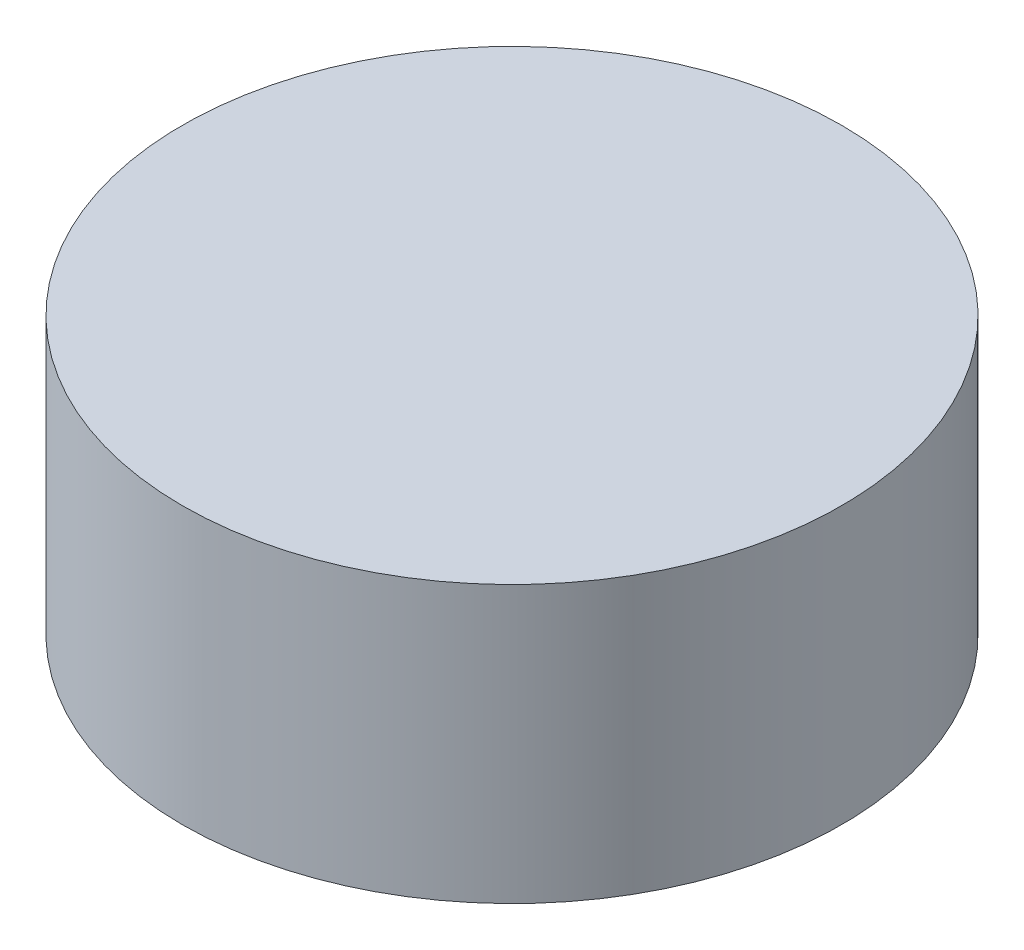
from build123d import *


with BuildPart() as part:
    # Sketch1 → Revolve1 (revolve)
    with BuildSketch(Plane(origin=(0, 0, 0), x_dir=(0, 0, -1), z_dir=(1, 0, 0)), mode=Mode.PRIVATE) as revolve1_sk:
        with BuildLine():
            Line((-44.200960454, 0), (-44.200960454, 26.734375))
            ThreePointArc((-44.200960454, 26.734375), (-41.272028266, 33.805442812), (-34.200960454, 36.734375))
            Line((-34.200960454, 36.734375), (0, 36.734375))
            Line((0, 36.734375), (0, 38.734375))
            Line((0, 38.734375), (-46.200960454, 38.734375))
            Line((-46.200960454, 38.734375), (-46.200960454, 0))
            Line((-46.200960454, 0), (-44.200960454, 0))
        make_face()
    revolve(revolve1_sk.sketch.rotate(Axis((0, -1000, 0), (0, 1, 0)), 180), axis=Axis((0, -1000, 0), (0, 1, 0)))


solid = part.part
